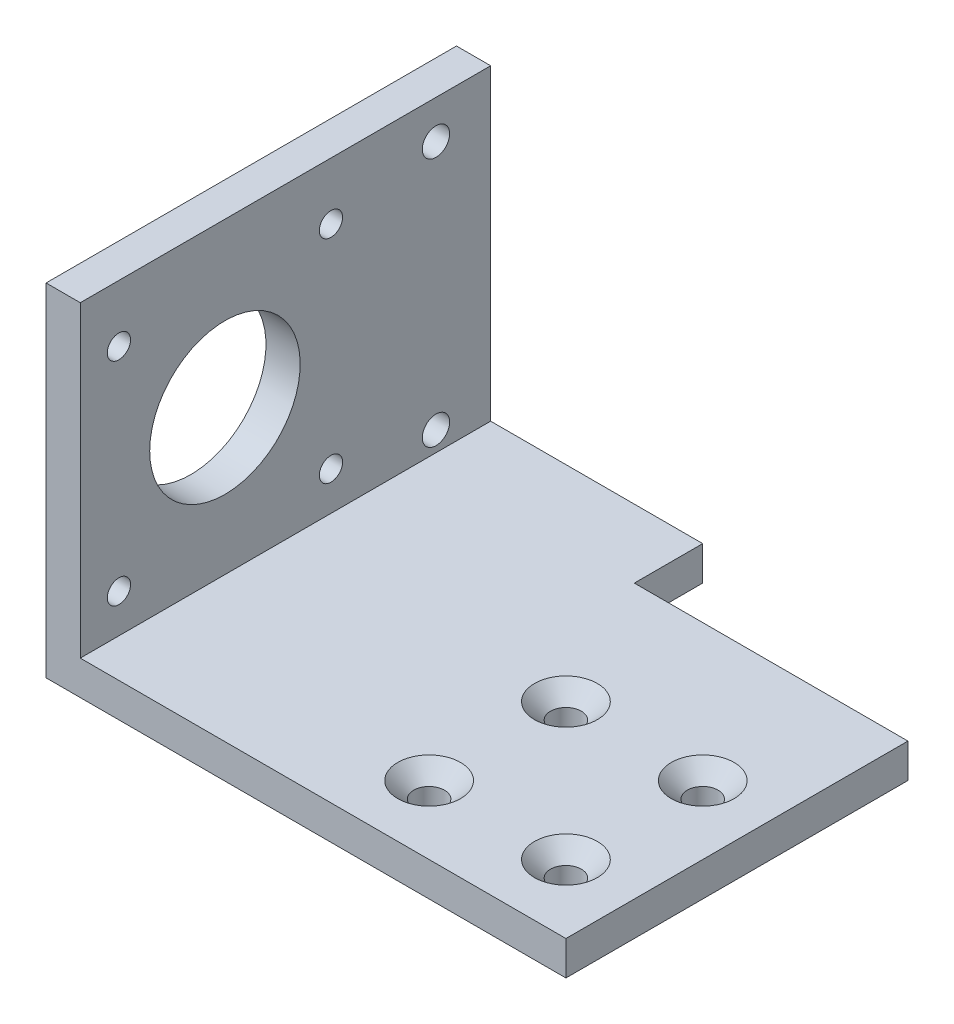
from build123d import *

# Parameters (mm, degrees)
EXTRUDE_1_DEPTH             = 60
SKETCH_2_R                  = 11
CUT_EXTRUDE_1_DEPTH         = 60
CSK_1_D                     = 3.4
CSK_1_DEPTH                 = 5
CSK_1_CSINK_D               = 6.94
CSK_1_CSINK_ANGLE           = 90
SKETCH_5_W                  = 64
SKETCH_5_H                  = 10
CUT_EXTRUDE_2_DEPTH         = 127.885775404
SKETCH_6_R                  = 2
CUT_EXTRUDE_3_DEPTH         = 10
SKETCH_7_R                  = 3
CUT_EXTRUDE_4_DEPTH         = 2
SKETCH_8_W                  = 24
SKETCH_8_H                  = 50
CUT_EXTRUDE_5_DEPTH         = 127.885775404
HOLE_WIZARD_M41_D           = 4.5
HOLE_WIZARD_M41_CSINK_D     = 9.18
HOLE_WIZARD_M41_CSINK_ANGLE = 90


with BuildPart() as part:
    # Эскиз1 → Бобышка-Вытянуть1 (new body)
    with BuildSketch(Plane.XY):
        Polygon((0, 0), (0, 50), (5, 50), (5, 5), (95, 5), (95, 50), (100, 50), (100, 0), align=None)
    extrude(amount=EXTRUDE_1_DEPTH)

    # Эскиз2 → Вырез-Вытянуть1 (cut)
    with BuildSketch(Plane.ZY):
        with Locations((38.85, 26.15)):
            Circle(SKETCH_2_R)
    extrude(amount=-CUT_EXTRUDE_1_DEPTH, mode=Mode.SUBTRACT)

    # CSK размера винта с полупотайной головкой и крестообразным шлицем1
    with Locations(Plane.ZY):
        with Locations((54.35, 10.65), (54.35, 41.65), (23.35, 41.65), (23.35, 10.65)):
            CounterSinkHole(CSK_1_D / 2, CSK_1_CSINK_D / 2, depth=CSK_1_DEPTH, counter_sink_angle=CSK_1_CSINK_ANGLE)

    # Эскиз5 → Вырез-Вытянуть2 (cut, through all)
    with BuildSketch(Plane.XZ):
        with Locations((68, 5)):
            Rectangle(SKETCH_5_W, SKETCH_5_H)
    extrude(amount=-CUT_EXTRUDE_2_DEPTH, mode=Mode.SUBTRACT)

    # Эскиз6 → Вырез-Вытянуть3 (cut)
    with BuildSketch(Plane.ZY):
        with Locations((8, 44.4)):
            Circle(SKETCH_6_R)
        with Locations((8, 7.9)):
            Circle(SKETCH_6_R)
    extrude(amount=-CUT_EXTRUDE_3_DEPTH, mode=Mode.SUBTRACT)

    # Эскиз7 → Вырез-Вытянуть4 (cut)
    with BuildSketch(Plane.ZY):
        with Locations((8, 44.4)):
            Circle(SKETCH_7_R)
        with Locations((8, 7.9)):
            Circle(SKETCH_7_R)
    extrude(amount=-CUT_EXTRUDE_4_DEPTH, mode=Mode.SUBTRACT)

    # Эскиз8 → Вырез-Вытянуть5 (cut, through all)
    with BuildSketch(Plane.XZ):
        with Locations((88, 35)):
            Rectangle(SKETCH_8_W, SKETCH_8_H)
    extrude(amount=-CUT_EXTRUDE_5_DEPTH, mode=Mode.SUBTRACT)

    # Зенковка для винта с потайной головкой и внутренним шестигранником M41 (through all)
    with Locations(Plane(origin=(0, 5, 0), x_dir=(-1, 0, 0), z_dir=(0, 1, 0))):
        with Locations((-46, 30), (-66, 30), (-46, 50), (-66, 50)):
            CounterSinkHole(HOLE_WIZARD_M41_D / 2, HOLE_WIZARD_M41_CSINK_D / 2, counter_sink_angle=HOLE_WIZARD_M41_CSINK_ANGLE)


solid = part.part
